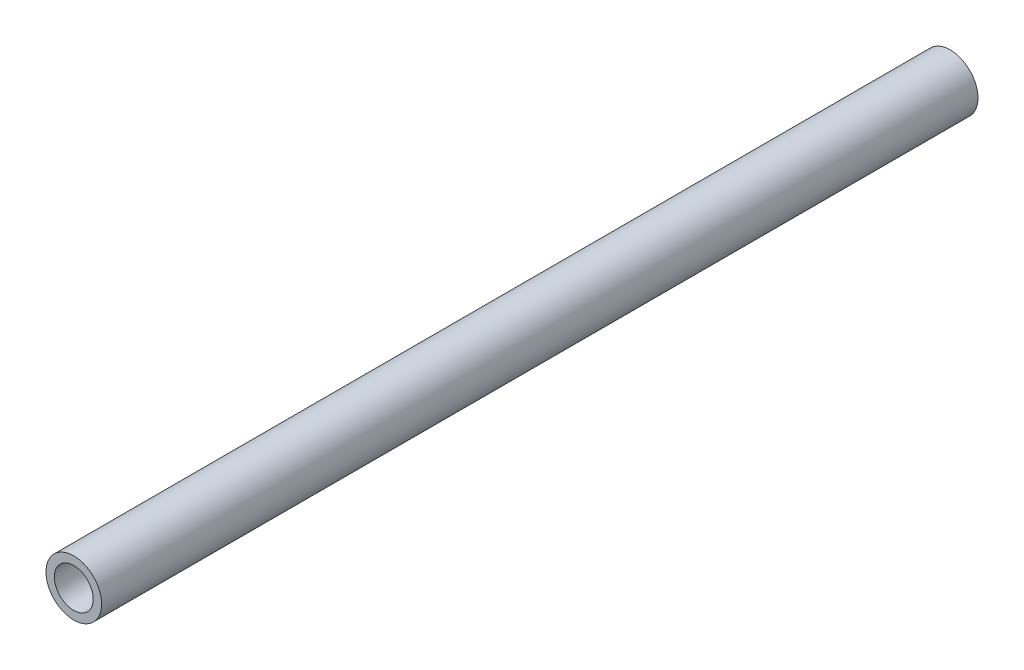
from build123d import *

# Parameters (mm, degrees)
SKETCH1_R           = 15.875
SKETCH1_R_2         = 11.1
BOSS_EXTRUDE1_DEPTH = 500


with BuildPart() as part:
    # Sketch1 → Boss-Extrude1 (new body)
    with BuildSketch(Plane(origin=(0, 0, 0), x_dir=(0, 1, 0), z_dir=(0, 0, 1))):
        with Locations(Location((0, 0, 0), (0, 0, 270))):
            Circle(SKETCH1_R)
        with Locations(Location((0, 0, 0), (0, 0, 270))):
            Circle(SKETCH1_R_2, mode=Mode.SUBTRACT)
    extrude(amount=BOSS_EXTRUDE1_DEPTH)


solid = part.part
